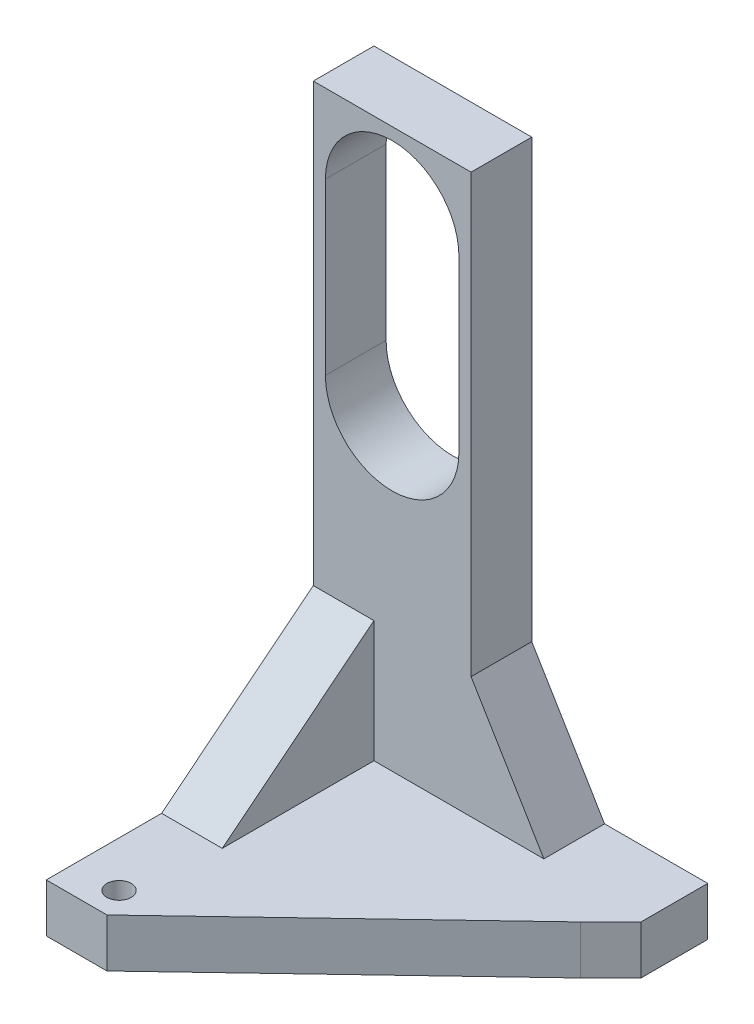
from build123d import *

# Parameters (mm, degrees)
SKETCH_2_W           = 26
SKETCH_2_H           = 97
EXTRUDE_1_DEPTH      = 10
CUT_EXTRUDE_11_DEPTH = 10
EXTRUDE_2_DEPTH      = 3
SKETCH_8_R           = 2
CUT_EXTRUDE_12_DEPTH = 3
EXTRUDE_3_DEPTH      = 5
CUT_EXTRUDE_START    = -10
SKETCH_10_R          = 2
CUT_EXTRUDE_13_DEPTH = 10
EXTRUDE_4_DEPTH      = 10
EXTRUDE_5_DEPTH      = 10
EXTRUDE_6_DEPTH      = 8


with BuildPart() as part:
    # 草图2 → 凸台-拉伸1 (new body)
    with BuildSketch(Plane.XY):
        with Locations((0, -10.25)):
            Rectangle(SKETCH_2_W, SKETCH_2_H)
    extrude(amount=EXTRUDE_1_DEPTH)

    # 草图3 → 切除-拉伸11 (cut)
    with BuildSketch(Plane.XY):
        with BuildLine():
            Line((-11, -2.75), (-11, 25.25))
            ThreePointArc((-11, 25.25), (0, 36.25), (11, 25.25))
            Line((11, 25.25), (11, -2.75))
            ThreePointArc((11, -2.75), (0, -13.75), (-11, -2.75))
        make_face()
    extrude(amount=CUT_EXTRUDE_11_DEPTH, mode=Mode.SUBTRACT)

    # 草图4 → 凸台-拉伸2 (add)
    with BuildSketch(Plane.XZ.offset(58.75)):
        Polygon((-13, 0), (37, 0), (37, 16), (-3, 54), (-13, 54), align=None)
    extrude(amount=EXTRUDE_2_DEPTH)

    # 草图8 → 切除-拉伸12 (cut)
    with BuildSketch(Plane.XZ.offset(61.75)):
        with Locations(Location((-5.5, 49.5, 0), (0, 0, 270))):
            Circle(SKETCH_8_R)
    extrude(amount=-CUT_EXTRUDE_12_DEPTH, mode=Mode.SUBTRACT)

    # 草图9 → 凸台-拉伸3 (add)
    with BuildSketch(Plane(origin=(0, -58.75, 0), x_dir=(1, 0, 0), z_dir=(0, 1, 0))):
        Polygon((-13, -10), (-13, -54), (-3, -54), (37, -16), (37, 0), (13, 0), (13, -10), align=None)
    extrude(amount=EXTRUDE_3_DEPTH)

    # 草图10 → 切除-拉伸13 (cut)
    with BuildSketch(Plane(origin=(0, -53.75, 0), x_dir=(1, 0, 0), z_dir=(0, 1, 0)).offset(CUT_EXTRUDE_START)):
        with Locations(Location((-5.5, -49.5, 0), (0, 0, 90))):
            Circle(SKETCH_10_R)
    extrude(amount=CUT_EXTRUDE_13_DEPTH, mode=Mode.SUBTRACT)

    # 草图11 → 凸台-拉伸4 (add)
    with BuildSketch(Plane(origin=(0, 0, 0), x_dir=(-1, 0, 0), z_dir=(0, 0, -1))):
        Polygon((-13, -33.75), (-13, -53.75), (-25, -53.75), align=None)
    extrude(amount=-EXTRUDE_4_DEPTH)

    # 草图12 → 凸台-拉伸5 (add)
    with BuildSketch(Plane.ZY.offset(13)):
        Polygon((10, -53.75), (35, -53.75), (10, -33.75), align=None)
    extrude(amount=-EXTRUDE_5_DEPTH)

    # 草图13 → 凸台-拉伸6 (add)
    with BuildSketch(Plane(origin=(0, -53.75, 0), x_dir=(1, 0, 0), z_dir=(0, 1, 0))):
        Polygon((37, 0), (42, 0), (42, -11), (37, -16), align=None)
    extrude(amount=-EXTRUDE_6_DEPTH)


solid = part.part
